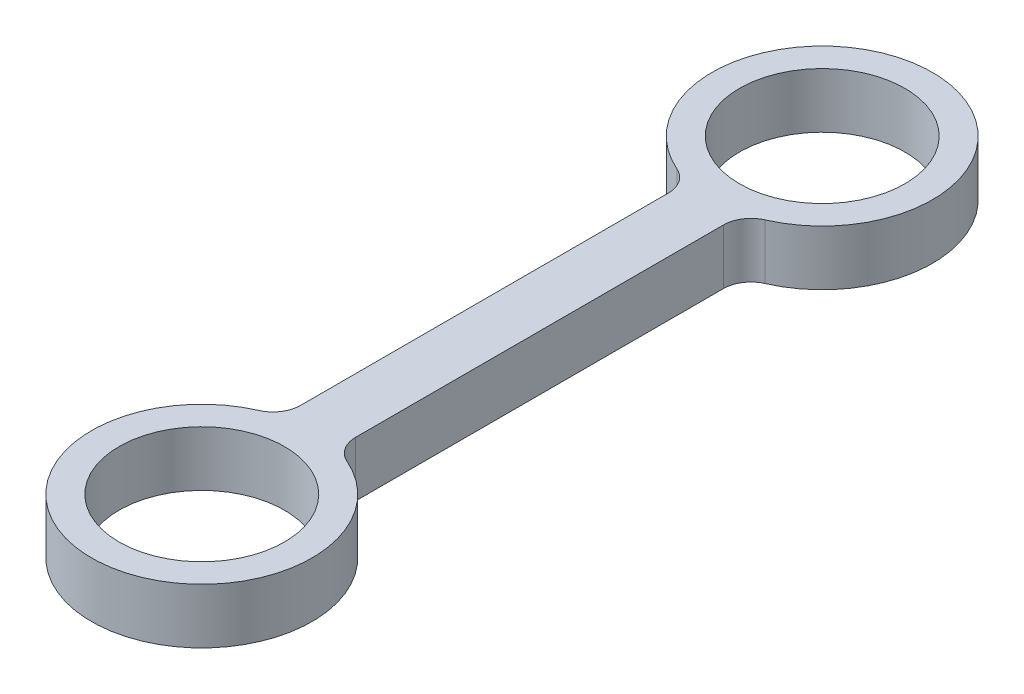
from build123d import *

# Parameters (mm, degrees)
SKETCH1_R           = 4
SKETCH1_R_2         = 3
BOSS_EXTRUDE1_DEPTH = 2
FILLET1_R           = 1


with BuildPart() as part:
    # Sketch1 → Boss-Extrude1 (new body)
    # profile 1 of 3: a face of its own
    with BuildSketch(Plane(origin=(0, 0, 0), x_dir=(1, 0, 0), z_dir=(0, 1, 0))):
        with Locations((0, 11.25)):
            Circle(SKETCH1_R)
        with Locations(Location((0, 11.25, 0), (0, 0, 270))):
            Circle(SKETCH1_R_2, mode=Mode.SUBTRACT)
    # profile 2 of 3: a face of its own
    with BuildSketch(Plane(origin=(0, 0, 0), x_dir=(1, 0, 0), z_dir=(0, 1, 0))):
        with BuildLine():
            Line((-1, 7.377016654), (-1, -7.377016654))
            ThreePointArc((-1, -7.377016654), (0, -7.25), (1, -7.377016654))
            Line((1, -7.377016654), (1, 7.377016654))
            ThreePointArc((1, 7.377016654), (0, 7.25), (-1, 7.377016654))
        make_face()
    # profile 3 of 3: a face of its own
    with BuildSketch(Plane(origin=(0, 0, 0), x_dir=(1, 0, 0), z_dir=(0, 1, 0))):
        with Locations((0, -11.25)):
            Circle(SKETCH1_R)
        with Locations(Location((0, -11.25, 0), (0, 0, 270))):
            Circle(SKETCH1_R_2, mode=Mode.SUBTRACT)
    extrude(amount=BOSS_EXTRUDE1_DEPTH)

    # Fillet1
    fillet1_edges = [part.edges().sort_by_distance(p)[0] for p in [
        (1, 1, -7.377016654),
        (1, 1, 7.377016654),
        (-1, 1, 7.377016654),
        (-1, 1, -7.377016654),
    ]]
    fillet(fillet1_edges, radius=FILLET1_R)


solid = part.part
